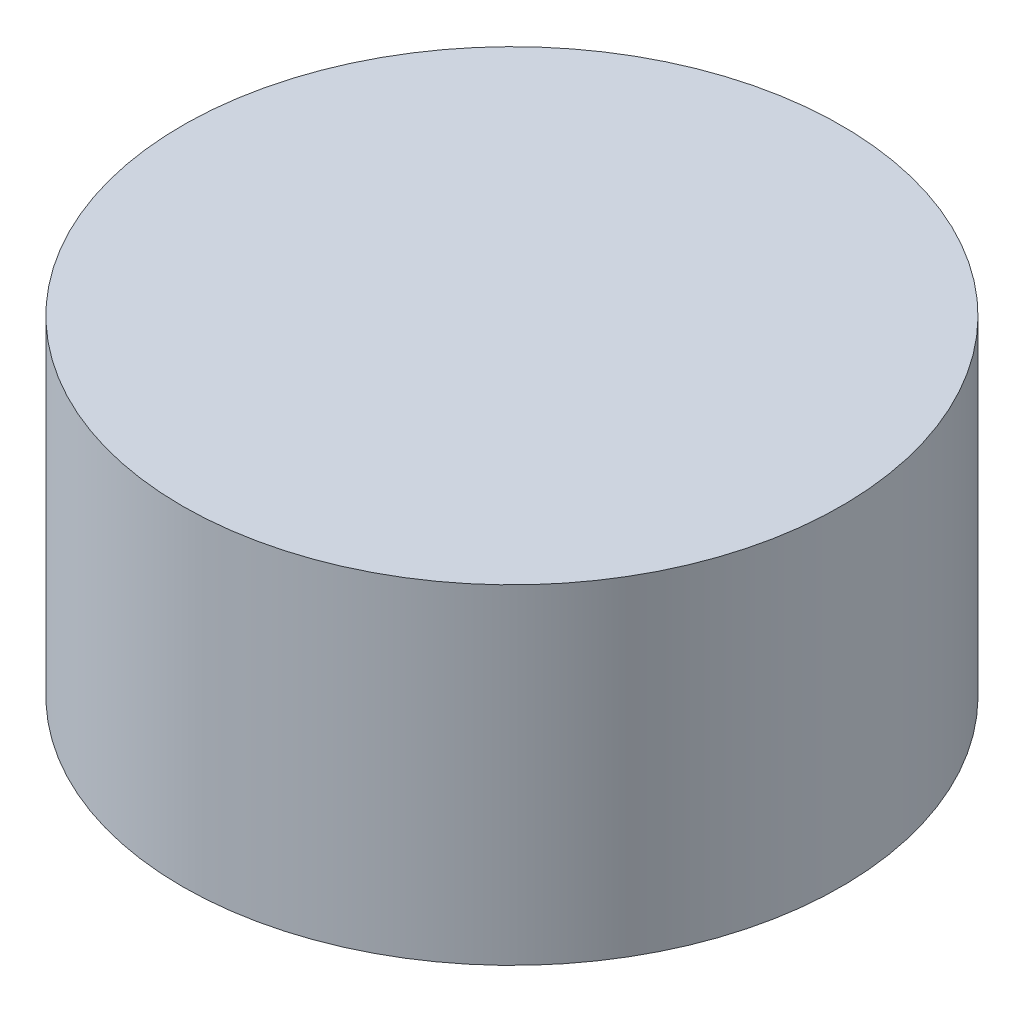
from build123d import *

# Parameters (mm, degrees)
SKETCH_1_R      = 5
EXTRUDE_1_DEPTH = 5


with BuildPart() as part:
    # 草图1 → 凸台-拉伸1 (new body)
    with BuildSketch(Plane(origin=(0, 0, 0), x_dir=(1, 0, 0), z_dir=(0, 1, 0))):
        with Locations(Location((0, 0, 0), (0, 0, 270))):
            Circle(SKETCH_1_R)
    extrude(amount=EXTRUDE_1_DEPTH)


solid = part.part
